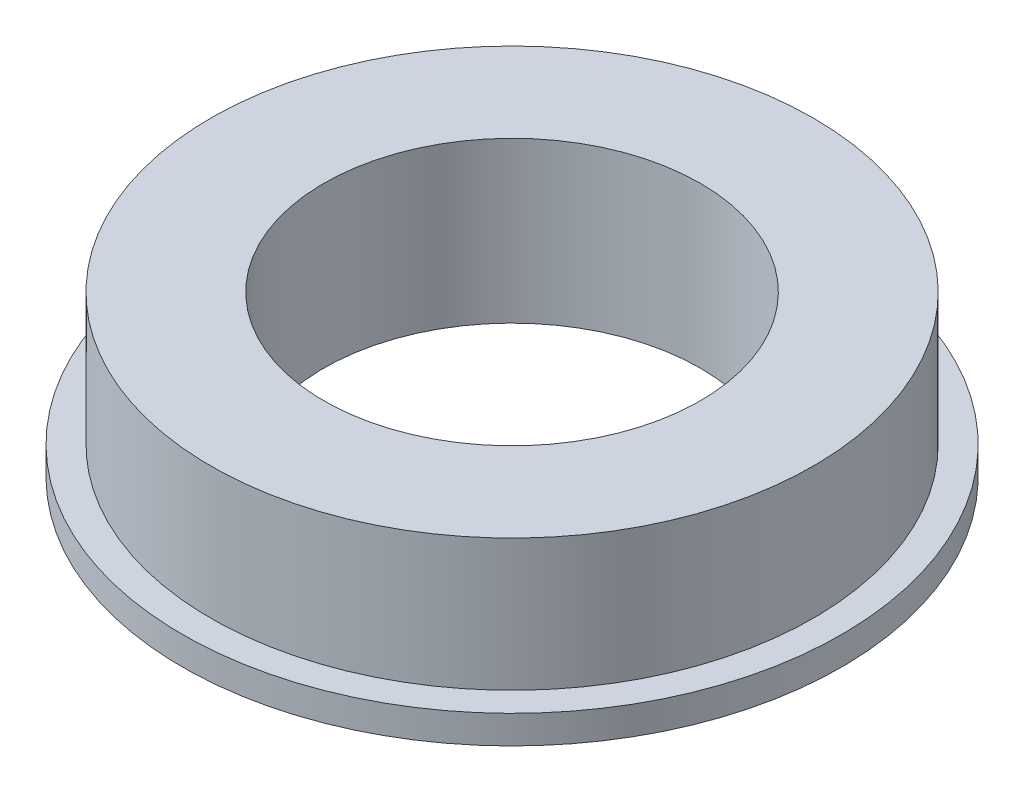
from build123d import *


with BuildPart() as part:
    # 草图1 → 旋转1 (revolve)
    with BuildSketch(Plane.XY, mode=Mode.PRIVATE) as revolve_1_sk:
        Polygon((16, 1.5), (16, 8.5), (10, 8.5), (10, 0), (17.5, 0), (17.5, 1.5), align=None)
    revolve(revolve_1_sk.sketch.rotate(Axis((0, 7, 0), (0, -1, 0)), 270), axis=Axis((0, 7, 0), (0, -1, 0)))


solid = part.part
